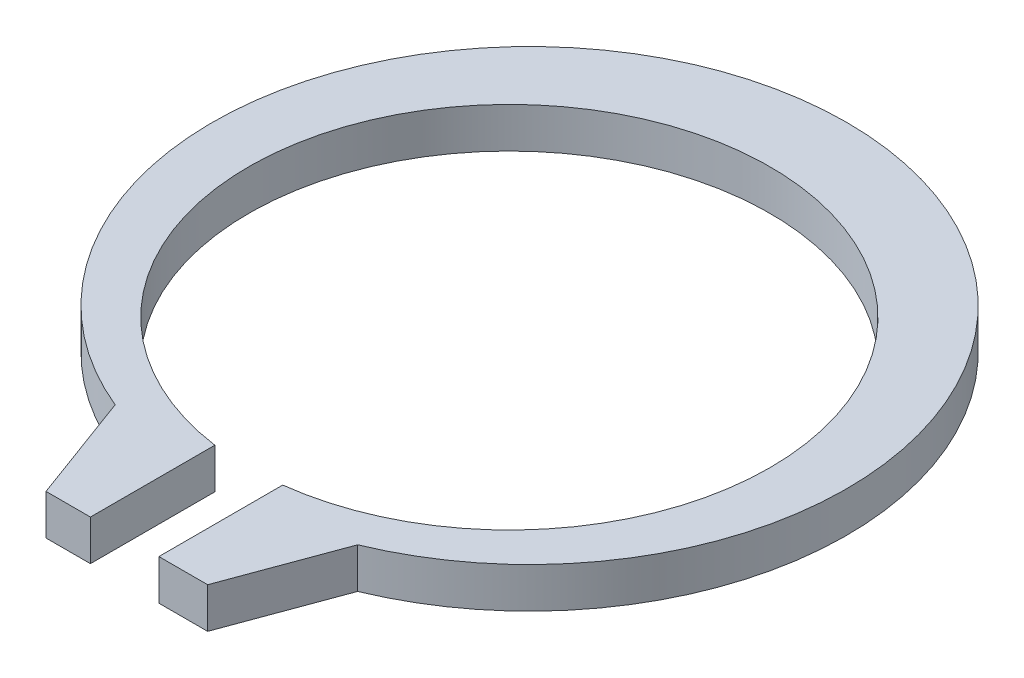
from build123d import *

# Parameters (mm, degrees)
SKETCH_1_R          = 6.45
EXTRUDE_1_DEPTH     = 1
SKETCH_2_W          = 1.693962672
SKETCH_2_H          = 6.211196465
CUT_EXTRUDE_1_DEPTH = 10


with BuildPart() as part:
    # 草图1 → 凸台-拉伸1 (new body)
    with BuildSketch(Plane(origin=(0, 0, 0), x_dir=(1, 0, 0), z_dir=(0, 1, 0))):
        with BuildLine():
            Line((0, -9.465309979), (2, -9.465309979))
            Line((2, -9.465309979), (3, -6.754136751))
            ThreePointArc((3, -6.754136751), (0, 8.35), (-3, -6.754136751))
            Line((-3, -6.754136751), (-2, -9.465309979))
            Line((-2, -9.465309979), (0, -9.465309979))
        make_face()
        with Locations(Location((0, 0, 0), (0, 0, 270))):
            Circle(SKETCH_1_R, mode=Mode.SUBTRACT)
    extrude(amount=EXTRUDE_1_DEPTH)

    # 草图2 → 切除-拉伸1 (cut)
    with BuildSketch(Plane(origin=(0, 1, 0), x_dir=(1, 0, 0), z_dir=(0, 1, 0))):
        with Locations((-0.053964614, -8.617371485)):
            Rectangle(SKETCH_2_W, SKETCH_2_H)
    extrude(amount=-CUT_EXTRUDE_1_DEPTH, mode=Mode.SUBTRACT)


solid = part.part
